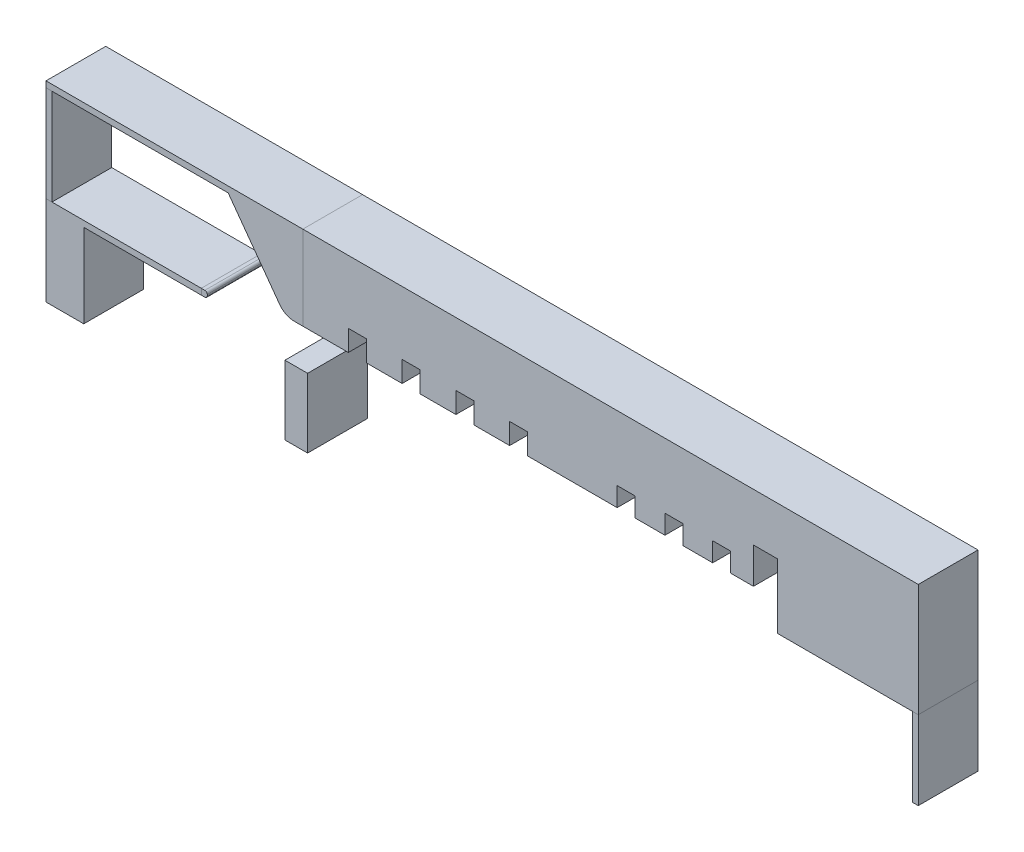
from build123d import *

# Parameters (mm, degrees)
EXTRUDE_1_DEPTH = 10
EXTRUDE_2_DEPTH = 10
EXTRUDE_3_DEPTH = 10
SKETCH_2_6_W    = 1
SKETCH_2_6_H    = 16.075509251
EXTRUDE_5_DEPTH = 10
SKETCH_2_10_W   = 3.795611852
SKETCH_2_10_H   = 11.568664648
EXTRUDE_7_DEPTH = 10
SKETCH_2_11_W   = 1
SKETCH_2_11_H   = 13.185519622
EXTRUDE_8_DEPTH = 10
EXTRUDE_9_DEPTH = 10


with BuildPart() as part:
    # 草图2 → 凸台-拉伸1 (new body)
    with BuildSketch(Plane.XY):
        with BuildLine():
            Line((-40, 32.075509251), (-40, 31.075509251))
            Line((-40, 31.075509251), (-39, 31.075509251))
            Line((-39, 31.075509251), (-9.497996654, 31.075509251))
            Line((-9.497996654, 31.075509251), (-0.898462522, 19.236877148))
            ThreePointArc((-0.898462522, 19.236877148), (0.166657912, 18.327045777), (1.52875766, 18))
            Line((1.52875766, 18), (3, 18))
            Line((3, 18), (3, 32.075509251))
            Line((3, 32.075509251), (-10.224392581, 32.075509251))
            Line((-10.224392581, 32.075509251), (-40, 32.075509251))
        make_face()
    extrude(amount=EXTRUDE_1_DEPTH)


with BuildPart() as body_2:
    # 草图2<3> → 凸台-拉伸2 (new body)
    with BuildSketch(Plane.XY):
        with BuildLine():
            Line((-14, 15), (-13.4, 15))
            ThreePointArc((-13.4, 15), (-13.117157288, 14.882842712), (-13, 14.6))
            Line((-13, 14.6), (-13, 14.4))
            ThreePointArc((-13, 14.4), (-13.117157288, 14.117157288), (-13.4, 14))
            Line((-13.4, 14), (-14, 14))
            Line((-14, 14), (-14, 15))
        make_face()
    extrude(amount=EXTRUDE_2_DEPTH)


with BuildPart() as body_3:
    # 草图2<4> → 凸台-拉伸3 (new body)
    with BuildSketch(Plane.XY):
        Polygon((-33.67892984, 14), (-14, 14), (-14, 15), (-17.067905555, 15), (-30.43187911, 15), (-39, 15), (-40, 15), (-40, 0), (-33.67892984, 0), align=None)
    extrude(amount=EXTRUDE_3_DEPTH)


with BuildPart() as body_4:
    # 草图2<6> → 凸台-拉伸5 (new body)
    with BuildSketch(Plane.XY):
        with Locations((-39.5, 23.037754626)):
            Rectangle(SKETCH_2_6_W, SKETCH_2_6_H)
    extrude(amount=EXTRUDE_5_DEPTH)


with BuildPart() as body_5:
    # 草图2<10> → 凸台-拉伸7 (new body)
    with BuildSketch(Plane.XY):
        with Locations((1.897805926, 5.784332324)):
            Rectangle(SKETCH_2_10_W, SKETCH_2_10_H)
    extrude(amount=EXTRUDE_7_DEPTH)


with BuildPart() as body_6:
    # 草图2<11> → 凸台-拉伸8 (new body)
    with BuildSketch(Plane.XY):
        with Locations((105.536052446, 6.592759811)):
            Rectangle(SKETCH_2_11_W, SKETCH_2_11_H)
    extrude(amount=EXTRUDE_8_DEPTH)


with BuildPart() as body_7:
    # 草图2<12> → 凸台-拉伸9 (new body)
    with BuildSketch(Plane.XY):
        Polygon((106.036052446, 32.075509251), (3, 32.075509251), (3, 18), (10.622289709, 18), (10.622289709, 21.5), (13.622289709, 21.5), (13.622289709, 18), (19.622289709, 18), (19.622289709, 21.5), (22.622289709, 21.5), (22.622289709, 18), (28.622289709, 18), (28.622289709, 21.5), (31.622289709, 21.5), (31.622289709, 18), (33.949970739, 18), (37.622289709, 18), (37.622289709, 21.5), (40.622289709, 21.5), (40.622289709, 18), (55.622289709, 18), (55.622289709, 21.2), (58.622289709, 21.2), (58.622289709, 18), (63.622289709, 18), (63.622289709, 21.2), (66.622289709, 21.2), (66.622289709, 18), (71.622289709, 18), (71.622289709, 21.2), (74.622289709, 21.2), (74.622289709, 18), (76.982050703, 18), (78.441533019, 18), (78.441533019, 24), (82.441533019, 24), (82.441533019, 13.185519622), (105.036052446, 13.185519622), (106.036052446, 13.185519622), align=None)
    extrude(amount=EXTRUDE_9_DEPTH)


solid = Compound([part.part, body_2.part, body_3.part, body_4.part, body_5.part, body_6.part, body_7.part])
